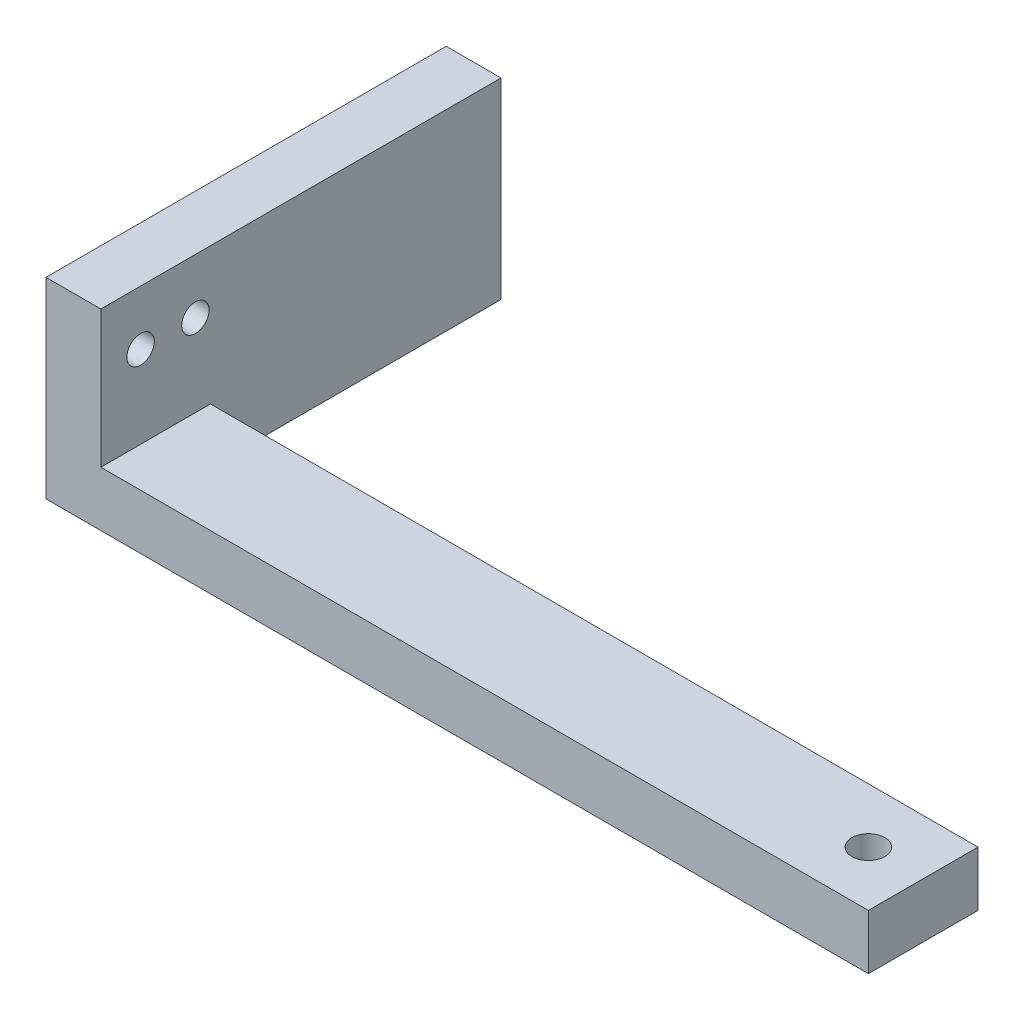
from build123d import *

# Parameters (mm, degrees)
SKETCH1_W           = 150
SKETCH1_H           = 20
BOSS_EXTRUDE1_DEPTH = 10
SKETCH2_R           = 3
CUT_EXTRUDE1_DEPTH  = 10
SKETCH3_W           = 23
SKETCH3_H           = 25
BOSS_EXTRUDE2_DEPTH = 10
SKETCH4_R           = 2.5
CUT_EXTRUDE2_DEPTH  = 480.576193501
BOSS_EXTRUDE4_START = -20
SKETCH5_W           = 10
SKETCH5_H           = 35
BOSS_EXTRUDE4_DEPTH = 53


with BuildPart() as part:
    # Sketch1 → Boss-Extrude1 (new body)
    with BuildSketch(Plane(origin=(0, 0, 0), x_dir=(1, 0, 0), z_dir=(0, 1, 0))):
        with Locations((-2472.770700637, 441.167728238)):
            Rectangle(SKETCH1_W, SKETCH1_H)
    extrude(amount=BOSS_EXTRUDE1_DEPTH)

    # Sketch2 → Cut-Extrude1 (cut)
    with BuildSketch(Plane(origin=(0, 10, 0), x_dir=(1, 0, 0), z_dir=(0, 1, 0))):
        with Locations(Location((-2407.770700637, 441.167728238, 0), (0, 0, 270))):
            Circle(SKETCH2_R)
    extrude(amount=-CUT_EXTRUDE1_DEPTH, mode=Mode.SUBTRACT)

    # Sketch3 → Boss-Extrude2 (add)
    with BuildSketch(Plane.ZY.offset(2547.770700637)):
        with Locations((-442.667728238, 22.5)):
            Rectangle(SKETCH3_W, SKETCH3_H)
    extrude(amount=-BOSS_EXTRUDE2_DEPTH)

    # Sketch4 → Cut-Extrude2 (cut, through all)
    with BuildSketch(Plane.ZY.offset(2547.770700637)):
        with Locations((-448.417728238, 25)):
            Circle(SKETCH4_R)
        with Locations((-438.417728238, 25)):
            Circle(SKETCH4_R)
    extrude(amount=-CUT_EXTRUDE2_DEPTH, mode=Mode.SUBTRACT)

    # Sketch5 → Boss-Extrude4 (add)
    with BuildSketch(Plane.XY.offset(-431.167728238).offset(BOSS_EXTRUDE4_START)):
        with Locations((-2542.770700637, 17.5)):
            Rectangle(SKETCH5_W, SKETCH5_H)
    extrude(amount=-BOSS_EXTRUDE4_DEPTH)


solid = part.part
